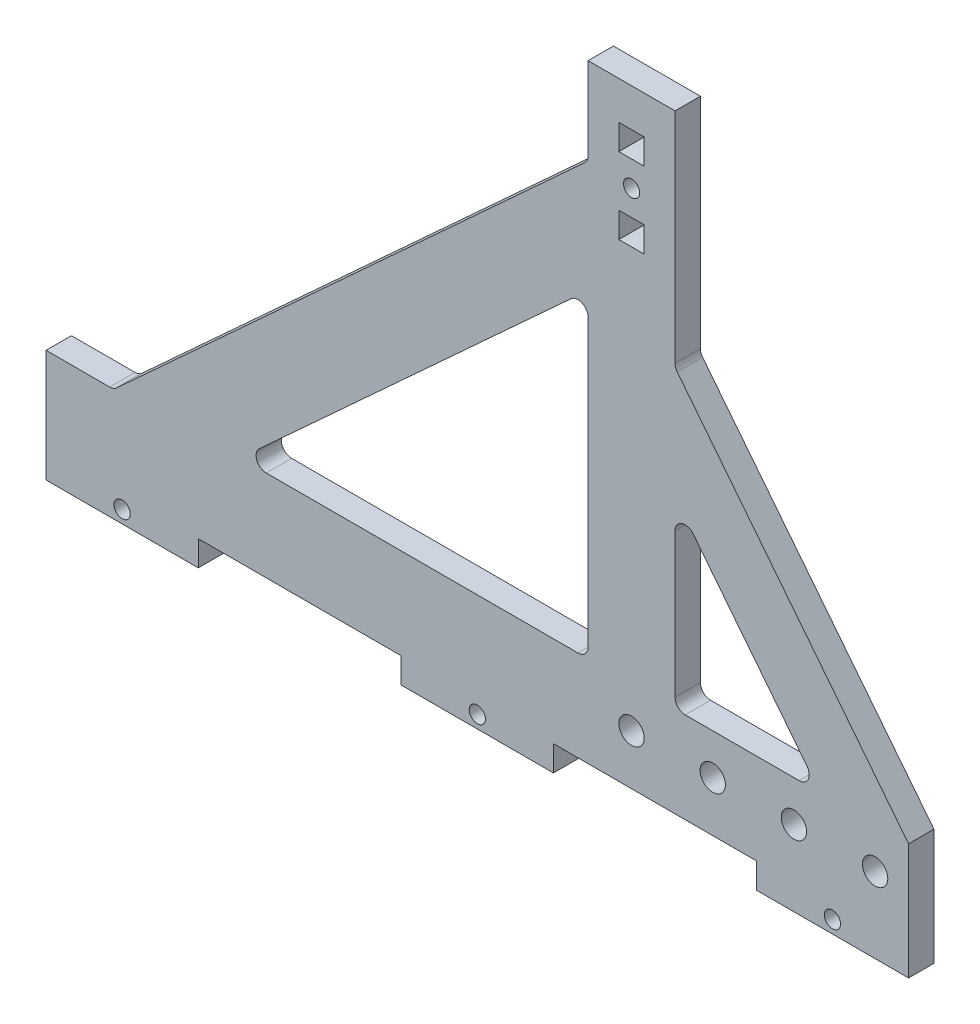
from build123d import *

# Parameters (mm, degrees)
SKETCH1_R           = 2.032
SKETCH1_W           = 6.35
SKETCH1_H           = 6.35
BOSS_EXTRUDE2_DEPTH = 6.35
CUT_EXTRUDE1_START  = -6.35
SKETCH3_R           = 3.175
CUT_EXTRUDE1_DEPTH  = 195.131829617


with BuildPart() as part:
    # Sketch1 → Boss-Extrude2 (new body)
    with BuildSketch(Plane.XY):
        with BuildLine():
            Line((21.7678, 129.667339502), (0, 129.667339502))
            Line((0, 129.667339502), (0, 109.016949915))
            ThreePointArc((0, 109.016949915), (-0.215035851, 107.994139226), (-0.823733627, 107.1445104))
            Line((-0.823733627, 107.1445104), (-118.042304389, -0.297300013))
            ThreePointArc((-118.042304389, -0.297300013), (-118.837809221, -0.792094788), (-119.758570763, -0.964860498))
            Line((-119.758570763, -0.964860498), (-135.676357929, -0.964860498))
            Line((-135.676357929, -0.964860498), (-135.676357929, -29.082660498))
            Line((-135.676357929, -29.082660498), (-97.576357929, -29.082660498))
            Line((-97.576357929, -29.082660498), (-97.576357929, -22.732660498))
            Line((-97.576357929, -22.732660498), (-46.776357929, -22.732660498))
            Line((-46.776357929, -22.732660498), (-46.776357929, -29.082660498))
            Line((-46.776357929, -29.082660498), (-8.676357929, -29.082660498))
            Line((-8.676357929, -29.082660498), (-8.676357929, -22.732660498))
            Line((-8.676357929, -22.732660498), (42.123642071, -22.732660498))
            Line((42.123642071, -22.732660498), (42.123642071, -29.082660498))
            Line((42.123642071, -29.082660498), (80.223642071, -29.082660498))
            Line((80.223642071, -29.082660498), (80.223642071, 0))
            Line((80.223642071, 0), (22.314225969, 73.349225433))
            ThreePointArc((22.314225969, 73.349225433), (21.908291921, 74.090114432), (21.7678, 74.923157637))
            Line((21.7678, 74.923157637), (21.7678, 129.667339502))
        make_face()
        with Locations((-116.626357929, -25.907660498)):
            Circle(SKETCH1_R, mode=Mode.SUBTRACT)
        with Locations((-27.726357929, -25.907660498)):
            Circle(SKETCH1_R, mode=Mode.SUBTRACT)
        with Locations((61.173642071, -25.907660498)):
            Circle(SKETCH1_R, mode=Mode.SUBTRACT)
        with Locations((10.8839, 107.442339502)):
            Circle(SKETCH1_R, mode=Mode.SUBTRACT)
        with BuildLine():
            Line((24.3078, 0), (52.822865129, 0))
            ThreePointArc((52.822865129, 0), (55.108624062, 1.432342065), (54.81643916, 4.113932204))
            Line((54.81643916, 4.113932204), (26.301374031, 40.231684398))
            ThreePointArc((26.301374031, 40.231684398), (23.474756795, 41.057260272), (21.7678, 38.657752193))
            Line((21.7678, 38.657752193), (21.7678, 2.54))
            ThreePointArc((21.7678, 2.54), (22.511748776, 0.743948776), (24.3078, 0))
        make_face(mode=Mode.SUBTRACT)
        with BuildLine():
            Line((0, 2.54), (0, 74.05849329))
            ThreePointArc((0, 74.05849329), (-1.517189311, 76.38345744), (-4.256266373, 75.930932805))
            Line((-4.256266373, 75.930932805), (-82.28264674, 4.412439515))
            ThreePointArc((-82.28264674, 4.412439515), (-82.933614657, 1.619238458), (-80.566380367, 0))
            Line((-80.566380367, 0), (-2.54, 0))
            ThreePointArc((-2.54, 0), (-0.743948776, 0.743948776), (0, 2.54))
        make_face(mode=Mode.SUBTRACT)
        with Locations((10.8839, 116.967339502)):
            Rectangle(SKETCH1_W, SKETCH1_H, mode=Mode.SUBTRACT)
        with Locations((10.8839, 97.917339502)):
            Rectangle(SKETCH1_W, SKETCH1_H, mode=Mode.SUBTRACT)
    extrude(amount=BOSS_EXTRUDE2_DEPTH)

    # Sketch3 → Cut-Extrude1 (cut, through all)
    with BuildSketch(Plane.XY.offset(6.35).offset(CUT_EXTRUDE1_START)):
        with Locations((10.8839, -10.16)):
            Circle(SKETCH3_R)
        with Locations((31.2039, -10.16)):
            Circle(SKETCH3_R)
        with Locations((51.5239, -10.16)):
            Circle(SKETCH3_R)
        with Locations((71.8439, -10.16)):
            Circle(SKETCH3_R)
    extrude(amount=CUT_EXTRUDE1_DEPTH, mode=Mode.SUBTRACT)


solid = part.part
